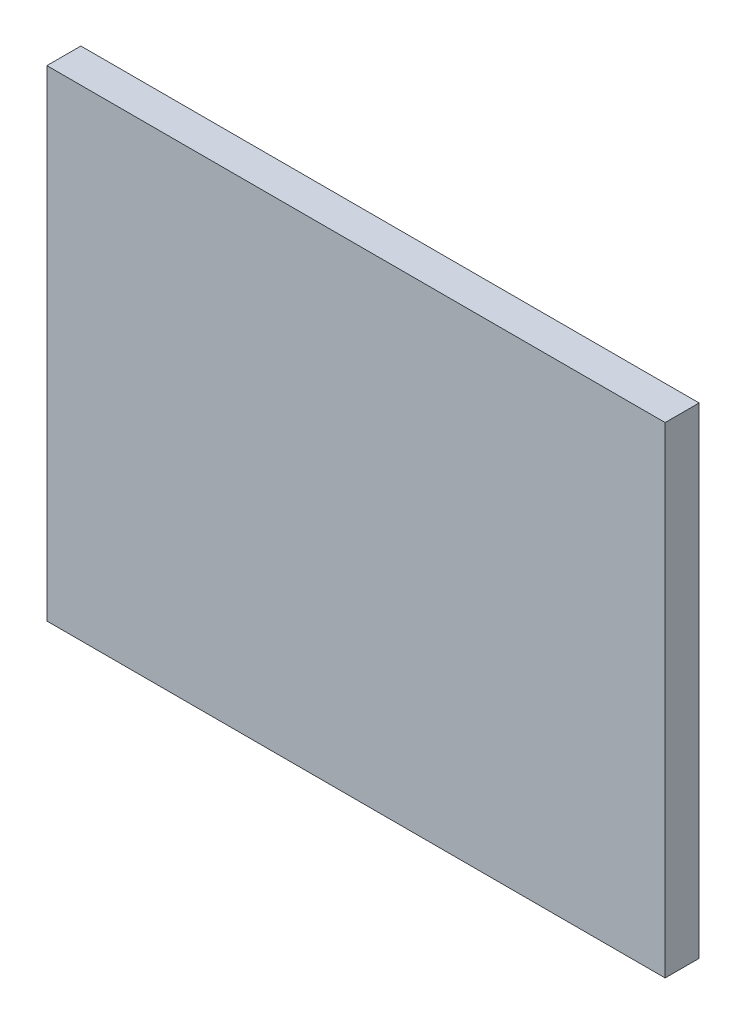
from build123d import *

# Parameters (mm, degrees)
SKETCH1_W      = 43.7
SKETCH1_H      = 34
ENVELOPE_DEPTH = 2.4


with BuildPart() as part:
    # Sketch1 → Envelope (new body)
    with BuildSketch(Plane.XY):
        Rectangle(SKETCH1_W, SKETCH1_H)
    extrude(amount=ENVELOPE_DEPTH)


solid = part.part
